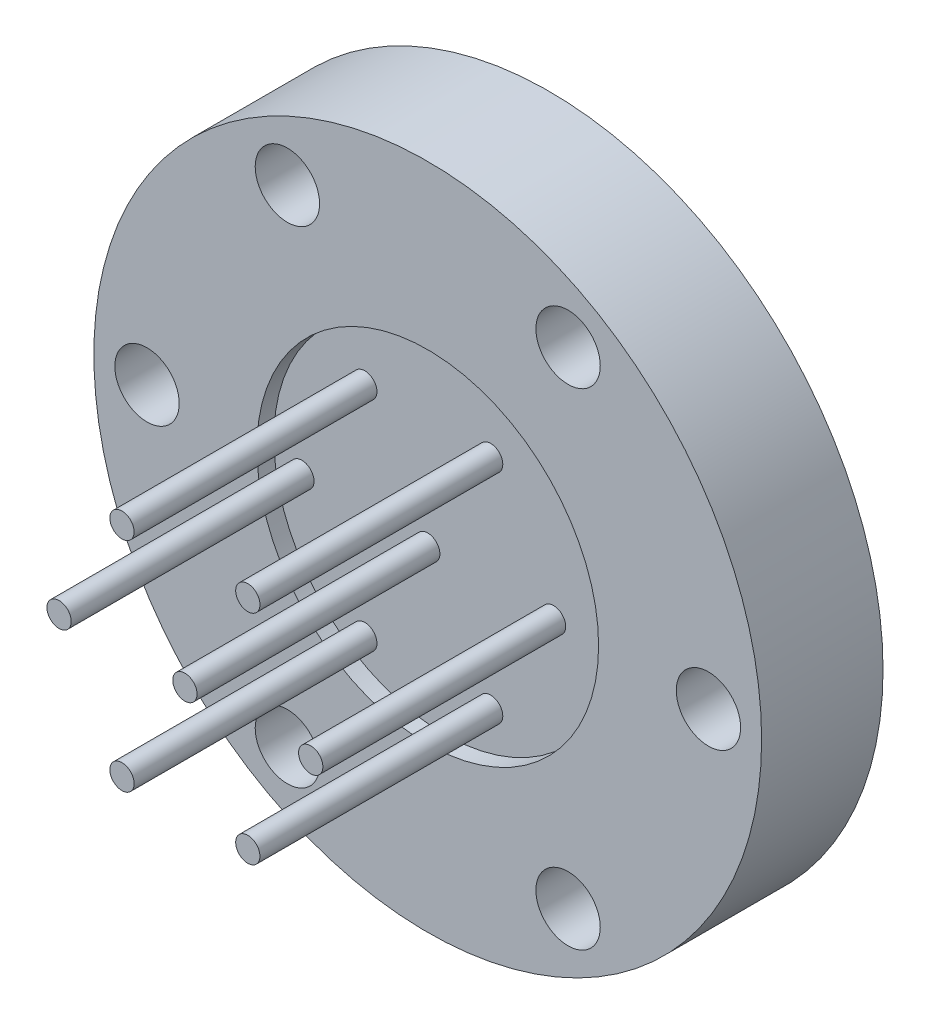
from build123d import *

# Parameters (mm, degrees)
SKETCH1_R          = 34.925
EXTRUDE1_DEPTH     = 12.7
SKETCH2_R          = 23.07082
CUT_EXTRUDE1_DEPTH = 1.999996
SKETCH3_R          = 1.27
EXTRUDE4_DEPTH     = 25.4
SKETCH4_R          = 17.873116296
CUT_EXTRUDE2_DEPTH = 1.778
SKETCH6_R          = 3.3655
CUT_EXTRUDE3_DEPTH = 63.378852586


with BuildPart() as part:
    # Sketch1 → Extrude1 (new body)
    with BuildSketch(Plane.XY):
        Circle(SKETCH1_R)
    extrude(amount=EXTRUDE1_DEPTH)

    # Sketch2 → Cut-Extrude1 (cut)
    with BuildSketch(Plane(origin=(0, 0, 0), x_dir=(-1, 0, 0), z_dir=(0, 0, -1))):
        Circle(SKETCH2_R)
    extrude(amount=-CUT_EXTRUDE1_DEPTH, mode=Mode.SUBTRACT)

    # Sketch3 → Extrude4 (add)
    with BuildSketch(Plane.XY.offset(12.7)):
        Circle(SKETCH3_R)
        with Locations((-6.580668236, 11.398051733)):
            Circle(SKETCH3_R)
        with Locations((6.580668236, 11.398051733)):
            Circle(SKETCH3_R)
        with Locations((13.161336472, 0)):
            Circle(SKETCH3_R)
        with Locations((6.580668236, -11.398051733)):
            Circle(SKETCH3_R)
        with Locations((-6.580668236, -11.398051733)):
            Circle(SKETCH3_R)
        with Locations((-13.161336472, 0)):
            Circle(SKETCH3_R)
    extrude(amount=EXTRUDE4_DEPTH)

    # Sketch4 → Cut-Extrude2 (cut)
    with BuildSketch(Plane.XY.offset(12.7)):
        Circle(SKETCH4_R)
    extrude(amount=-CUT_EXTRUDE2_DEPTH, mode=Mode.SUBTRACT)


with BuildPart() as cut_extrude2_piece_1:
    # of the separate pieces the step leaves, piece 1, a body of its own (cut_extrude2_pieces)
    add(part.part.solids().sort_by_distance((34.925, 0, 0))[0])

    # Sketch6 → Cut-Extrude3 (cut, through all)
    with BuildSketch(Plane(origin=(0, 0, 0), x_dir=(-1, 0, 0), z_dir=(0, 0, -1))):
        with Locations((-14.6812, 25.428584316)):
            Circle(SKETCH6_R)
        with Locations((14.6812, 25.428584316)):
            Circle(SKETCH6_R)
        with Locations((29.3624, 0)):
            Circle(SKETCH6_R)
        with Locations((14.6812, -25.428584316)):
            Circle(SKETCH6_R)
        with Locations((-14.6812, -25.428584316)):
            Circle(SKETCH6_R)
        with Locations((-29.3624, 0)):
            Circle(SKETCH6_R)
    extrude(amount=-CUT_EXTRUDE3_DEPTH, mode=Mode.SUBTRACT)


with BuildPart() as cut_extrude2_piece_2:
    # of the separate pieces the step leaves, piece 2, a body of its own (cut_extrude2_pieces)
    add(part.part.solids().sort_by_distance((-11.891336472, 0, 12.7))[0])


with BuildPart() as cut_extrude2_piece_3:
    # of the separate pieces the step leaves, piece 3, a body of its own (cut_extrude2_pieces)
    add(part.part.solids().sort_by_distance((14.431336472, 0, 12.7))[0])


with BuildPart() as cut_extrude2_piece_4:
    # of the separate pieces the step leaves, piece 4, a body of its own (cut_extrude2_pieces)
    add(part.part.solids().sort_by_distance((-5.310668236, -11.398051733, 12.7))[0])


with BuildPart() as cut_extrude2_piece_5:
    # of the separate pieces the step leaves, piece 5, a body of its own (cut_extrude2_pieces)
    add(part.part.solids().sort_by_distance((-5.310668236, 11.398051733, 12.7))[0])


with BuildPart() as cut_extrude2_piece_6:
    # of the separate pieces the step leaves, piece 6, a body of its own (cut_extrude2_pieces)
    add(part.part.solids().sort_by_distance((7.850668236, 11.398051733, 12.7))[0])


with BuildPart() as cut_extrude2_piece_7:
    # of the separate pieces the step leaves, piece 7, a body of its own (cut_extrude2_pieces)
    add(part.part.solids().sort_by_distance((1.27, 0, 12.7))[0])


with BuildPart() as cut_extrude2_piece_8:
    # of the separate pieces the step leaves, piece 8, a body of its own (cut_extrude2_pieces)
    add(part.part.solids().sort_by_distance((7.850668236, -11.398051733, 12.7))[0])


solid = Compound([cut_extrude2_piece_1.part, cut_extrude2_piece_2.part, cut_extrude2_piece_3.part, cut_extrude2_piece_4.part, cut_extrude2_piece_5.part, cut_extrude2_piece_6.part, cut_extrude2_piece_7.part, cut_extrude2_piece_8.part])
